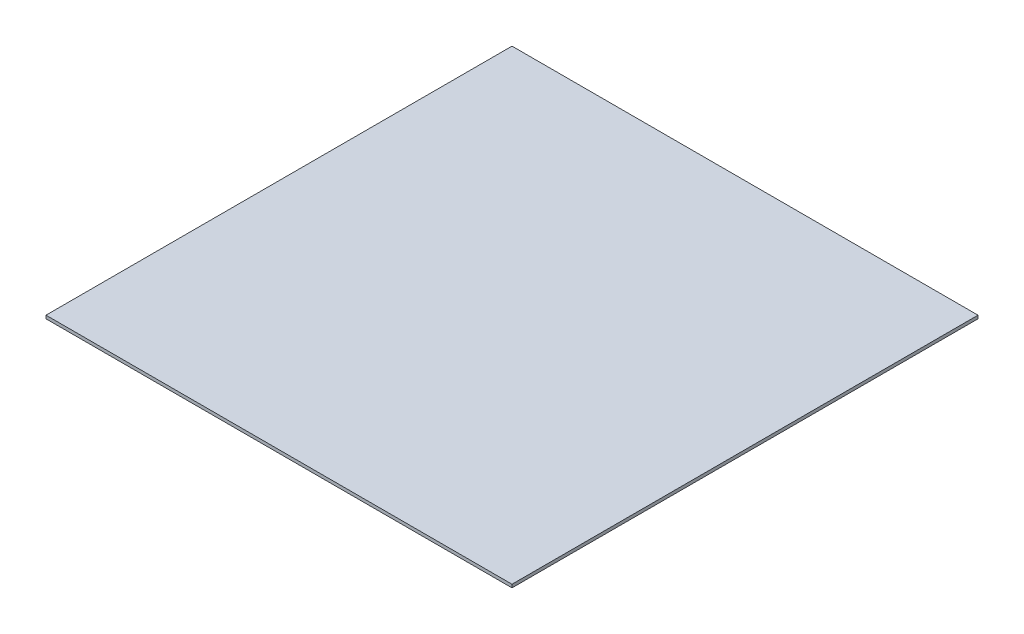
from build123d import *

# Parameters (mm, degrees)
SKETCH1_W           = 22
SKETCH1_H           = 22
BOSS_EXTRUDE1_DEPTH = 0.15


with BuildPart() as part:
    # Sketch1 → Boss-Extrude1 (new body)
    with BuildSketch(Plane(origin=(0, 0, 0), x_dir=(1, 0, 0), z_dir=(0, 1, 0))):
        Rectangle(SKETCH1_W, SKETCH1_H)
    extrude(amount=BOSS_EXTRUDE1_DEPTH)


solid = part.part
